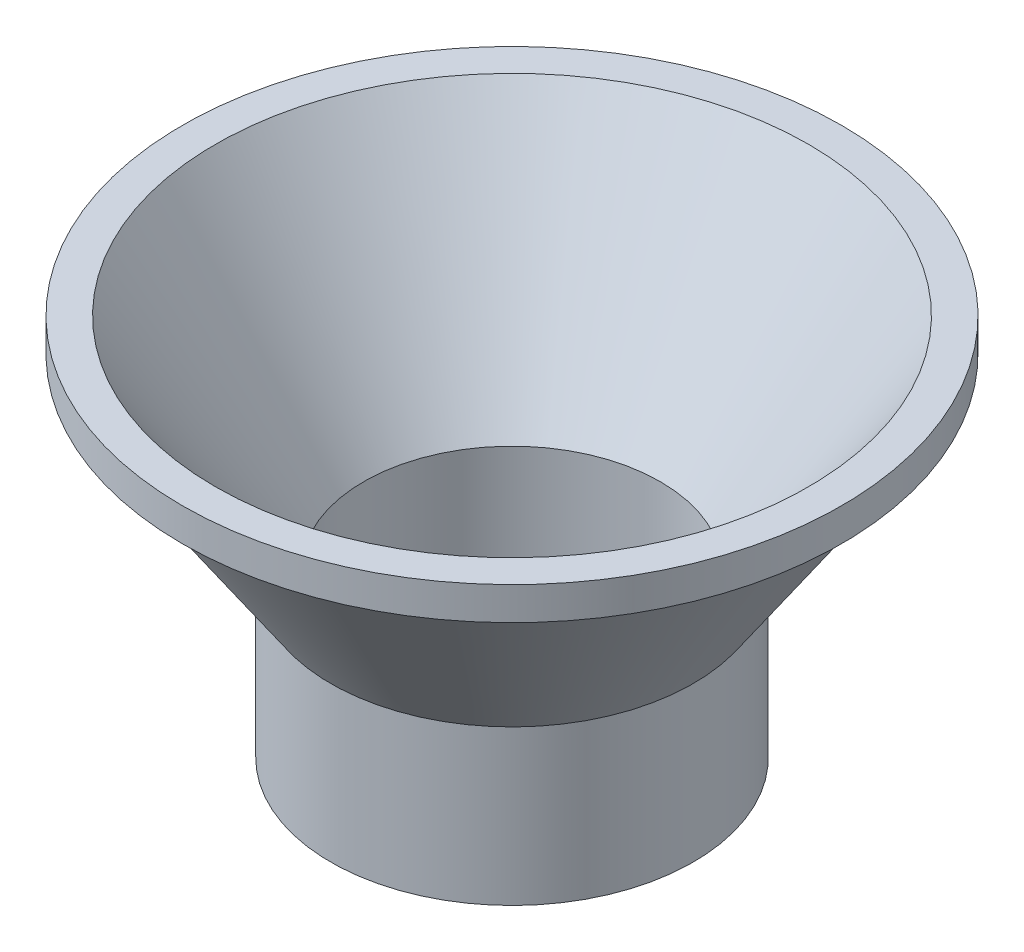
from build123d import *


with BuildPart() as part:
    # Sketch1 → Revolve-Thin3 (revolve)
    with BuildSketch(Plane.XY, mode=Mode.PRIVATE) as revolve_thin3_sk:
        Polygon((-20, 13.228756555), (-18, 13.228756555), (-9, 0), (-9, -10), (-11, -10), (-11, -0.615831877), (-19.058300524, 11.228756555), (-20, 11.228756555), align=None)
    revolve(revolve_thin3_sk.sketch.rotate(Axis((0, 0, 0), (0, 1, 0)), 270), axis=Axis((0, 0, 0), (0, 1, 0)))


solid = part.part
